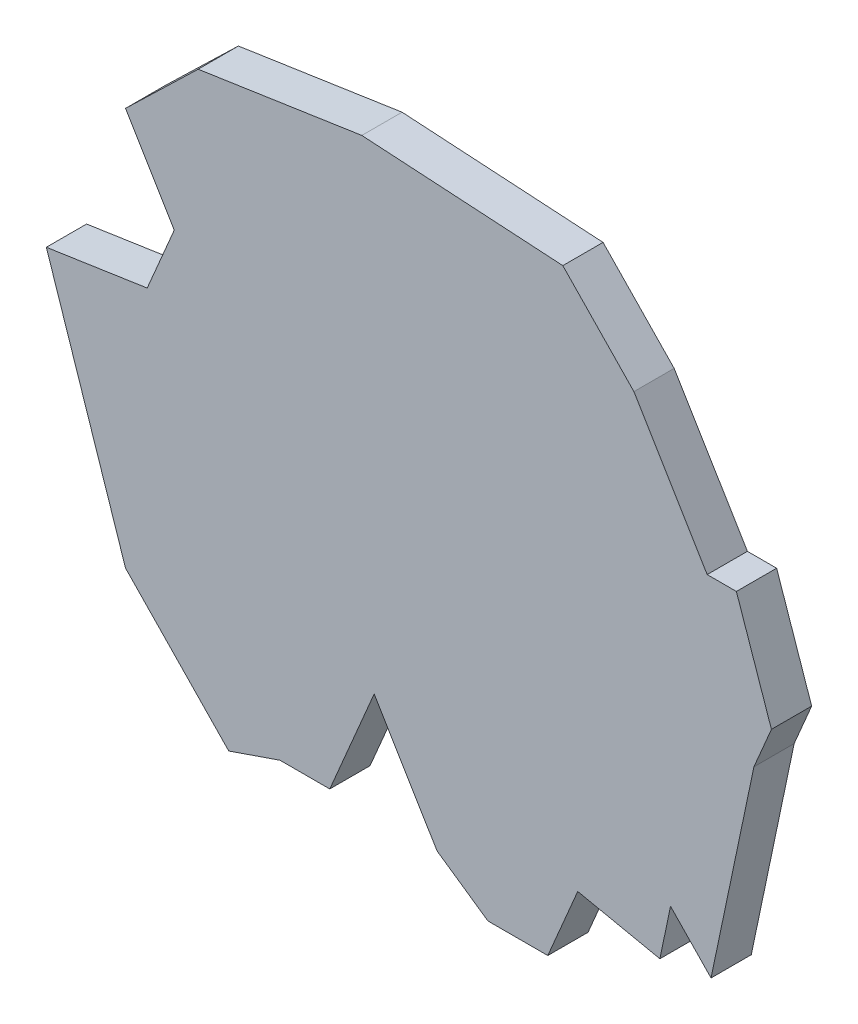
from build123d import *

# Parameters (mm, degrees)
EXTRUDE_1_DEPTH = 10


with BuildPart() as part:
    # Эскиз1 → Бобышка-Вытянуть1 (new body)
    with BuildSketch(Plane.XY):
        Polygon((-103.993643731, 0), (-78.925662608, 3.754498972), (-72.197529524, 19.585400347), (-84.314306648, 39.733314808), (-66.260941509, 57.183791111), (-25.579077457, 63.276823335), (24.37096886, 60.230307223), (42.037652278, 41.953265323), (60.249769824, 11.669949659), (67.510175105, 11.669949659), (76.217170861, -13.65949254), (71.863672983, -23.903016958), (63.879972465, -61.943741732), (61.205608948, -74.686545179), (51.143711051, -64.277023194), (48.493055515, -76.90686289), (28.080911747, -72.622916048), (20.636753175, -90.138583276), (5.769659745, -90.138583276), (-6.895061355, -81.380749662), (-22.512646554, -55.411651819), (-33.549513137, -81.380749662), (-45.920009483, -81.380749662), (-58.658676558, -85.759666469), (-84.314306648, -59.21767129), align=None)
    extrude(amount=EXTRUDE_1_DEPTH)


solid = part.part
